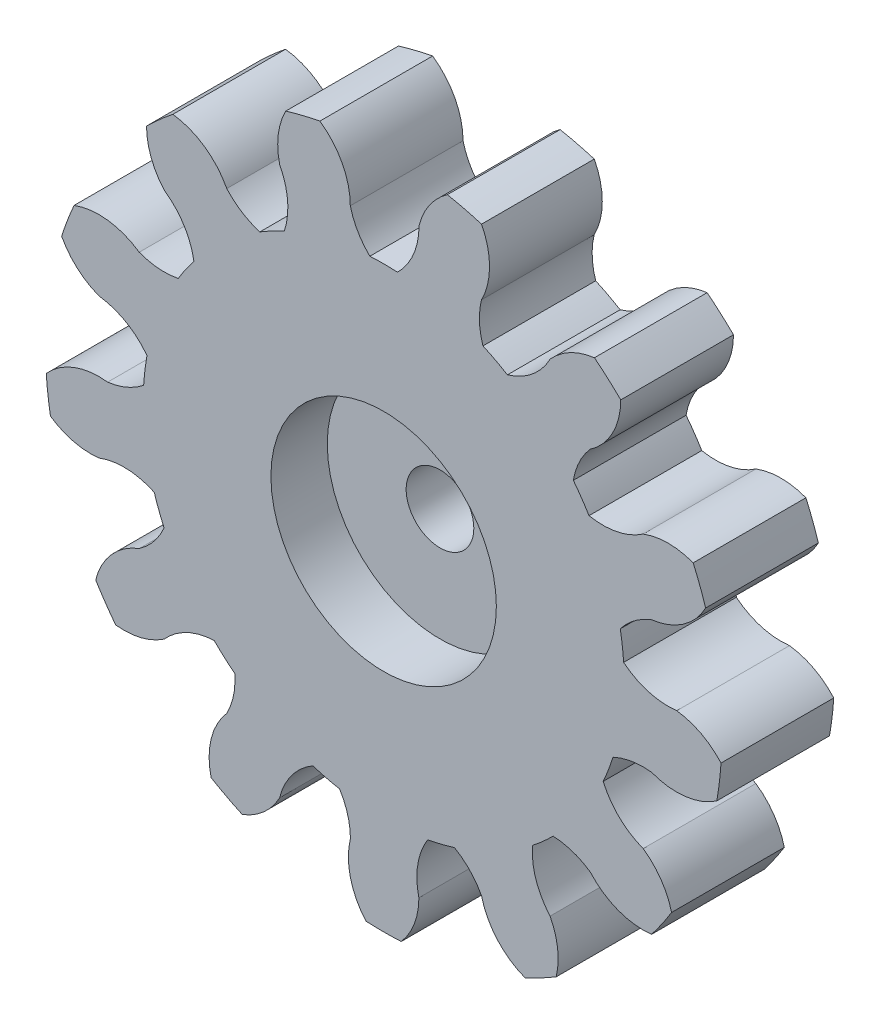
from build123d import *

# Parameters (mm, degrees)
CROQUIS1_R              = 15
CROQUIS1_R_2            = 1.5
SALIENTE_EXTRUIR1_DEPTH = 5
CORTAR_EXTRUIR1_DEPTH   = 22.794494718
MATRIZC1_COUNT          = 13
CROQUIS3_R              = 5
CORTAR_EXTRUIR2_DEPTH   = 2.5


with BuildPart() as part:
    # Croquis1 → Saliente-Extruir1 (new body)
    with BuildSketch(Plane.XY):
        Circle(CROQUIS1_R)
        Circle(CROQUIS1_R_2, mode=Mode.SUBTRACT)
    extrude(amount=SALIENTE_EXTRUIR1_DEPTH)

    # Croquis2 → Cortar-Extruir1 (cut, through all)
    with BuildSketch(Plane.XY.offset(5)):
        with BuildLine():
            ThreePointArc((2.827423232, 14.731112581), (0, 15), (-2.827423232, 14.731112581))
            ThreePointArc((-2.827423232, 14.731112581), (-1.836024404, 13.60728926), (-1.478404899, 12.151968408))
            ThreePointArc((-1.478404899, 12.151968408), (-1.151515386, 11.338657004), (-0.612545475, 10.64739466))
            ThreePointArc((-0.612545475, 10.64739466), (0, 10.665), (0.612545475, 10.64739466))
            ThreePointArc((0.612545475, 10.64739466), (1.320743225, 11.678795886), (1.57, 12.904847926))
            ThreePointArc((1.57, 12.904847926), (2.032147713, 13.93266315), (2.827423232, 14.731112581))
        make_face()
    cortar_extruir1 = extrude(amount=-CORTAR_EXTRUIR1_DEPTH, mode=Mode.SUBTRACT)

    # MatrizC1: Cortar-Extruir1 ×13 about axis
    matrizc1_axis = Axis((0, 0, 0), (0, 0, 1))
    for i in range(1, MATRIZC1_COUNT):
        add(cortar_extruir1.rotate(matrizc1_axis, i * 360 / MATRIZC1_COUNT), mode=Mode.SUBTRACT)

    # Croquis3 → Cortar-Extruir2 (cut)
    with BuildSketch(Plane.XY.offset(5)):
        Circle(CROQUIS3_R)
    extrude(amount=-CORTAR_EXTRUIR2_DEPTH, mode=Mode.SUBTRACT)


solid = part.part
